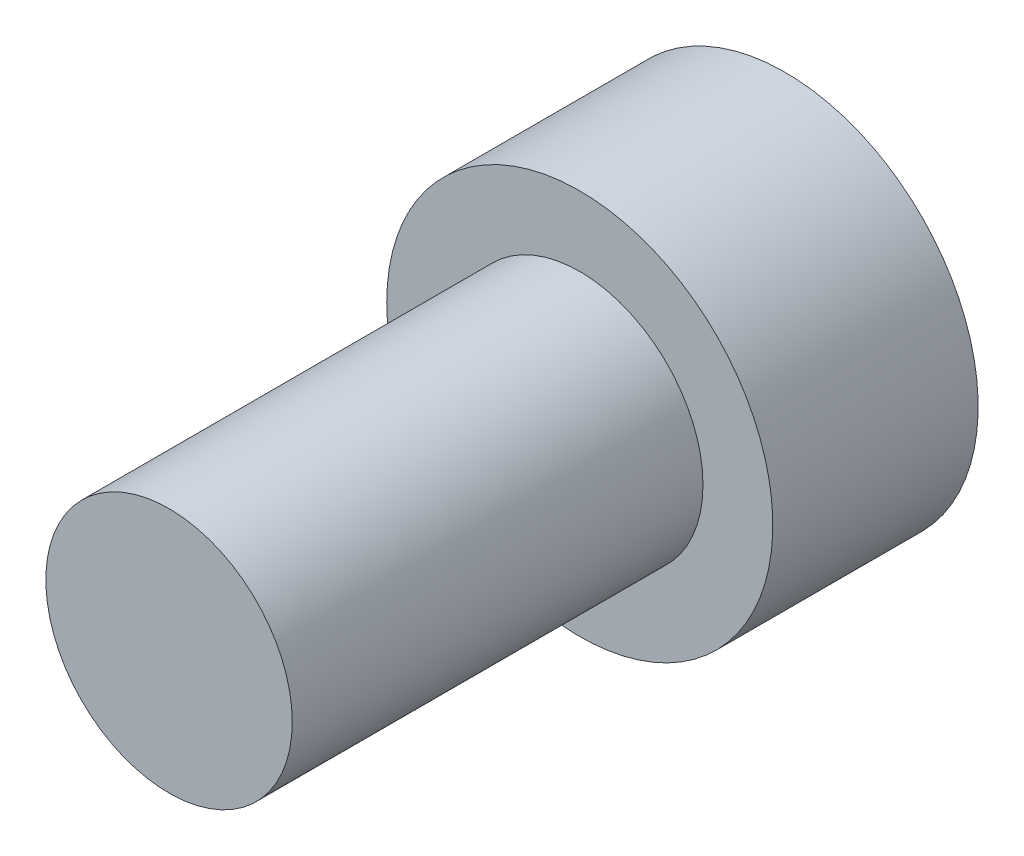
from build123d import *

# Parameters (mm, degrees)
SKETCH1_R           = 1.5
BOSS_EXTRUDE1_DEPTH = 5
SKETCH2_R           = 2.35
BOSS_EXTRUDE2_DEPTH = 2.5


with BuildPart() as part:
    # Sketch1 → Boss-Extrude1 (new body)
    with BuildSketch(Plane.XY):
        Circle(SKETCH1_R)
    extrude(amount=BOSS_EXTRUDE1_DEPTH)

    # Sketch2 → Boss-Extrude2 (add)
    with BuildSketch(Plane(origin=(0, 0, 0), x_dir=(-1, 0, 0), z_dir=(0, 0, -1))):
        Circle(SKETCH2_R)
    extrude(amount=BOSS_EXTRUDE2_DEPTH)


solid = part.part
